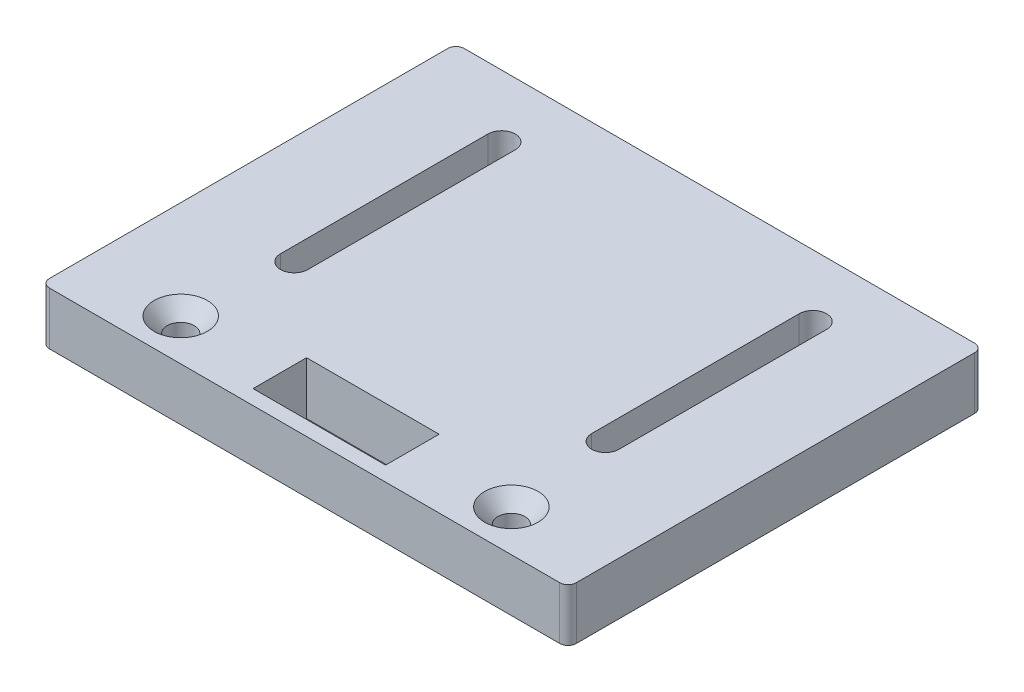
from build123d import *

# Parameters (mm, degrees)
SKETCH1_W                                        = 127
SKETCH1_H                                        = 100
BOSS_EXTRUDE1_DEPTH                              = 12.7
CUT_EXTRUDE1_DEPTH                               = 12.7
CUT_EXTRUDE2_DEPTH                               = 163.142807426
FILLET1_R                                        = 2
CSK_FOR_1_4_FLAT_HEAD_MACHINE_SCREW1_D           = 6.5278
CSK_FOR_1_4_FLAT_HEAD_MACHINE_SCREW1_CSINK_D     = 12.8778
CSK_FOR_1_4_FLAT_HEAD_MACHINE_SCREW1_CSINK_ANGLE = 82


with BuildPart() as part:
    # Sketch1 → Boss-Extrude1 (new body)
    with BuildSketch(Plane(origin=(0, 0, 0), x_dir=(1, 0, 0), z_dir=(0, 1, 0))):
        with Locations((63.5, 50)):
            Rectangle(SKETCH1_W, SKETCH1_H)
    extrude(amount=BOSS_EXTRUDE1_DEPTH)

    # Sketch2 → Cut-Extrude1 (cut)
    with BuildSketch(Plane(origin=(0, 12.7, 0), x_dir=(1, 0, 0), z_dir=(0, 1, 0))):
        Polygon((47.53, 10), (47.53, 16.45), (79.48, 16.45), (79.48, 10), (79.48, 3.55), (47.53, 3.55), align=None)
    extrude(amount=-CUT_EXTRUDE1_DEPTH, mode=Mode.SUBTRACT)

    # Sketch6 → Cut-Extrude2 (cut, through all)
    with BuildSketch(Plane(origin=(0, 12.7, 0), x_dir=(1, 0, 0), z_dir=(0, 1, 0))):
        with BuildLine():
            Line((22.690847092, 35), (22.690847092, 85))
            ThreePointArc((22.690847092, 85), (25.990847092, 88.3), (29.290847092, 85))
            Line((29.290847092, 85), (29.290847092, 35))
            ThreePointArc((29.290847092, 35), (25.990847092, 31.7), (22.690847092, 35))
        make_face()
        with BuildLine():
            Line((97.720847092, 35.000004619), (97.720847092, 84.999995381))
            ThreePointArc((97.720847092, 84.999995381), (100.881876157, 88.297072501), (104.30914268, 85.2776907))
            Line((104.30914268, 85.2776907), (104.30914268, 35.2776907))
            ThreePointArc((104.30914268, 35.2776907), (101.159813412, 31.702927304), (97.720847092, 35.000004619))
        make_face()
    extrude(amount=-CUT_EXTRUDE2_DEPTH, mode=Mode.SUBTRACT)

    # Fillet1
    fillet1_edges = [part.edges().sort_by_distance(p)[0] for p in [
        (0, 6.35, -100),
        (127, 6.35, -100),
        (127, 6.35, 0),
        (0, 6.35, 0),
    ]]
    fillet(fillet1_edges, radius=FILLET1_R)

    # CSK for 1/4 Flat Head Machine Screw1 (through all)
    with Locations(Plane(origin=(23.65, 12.7, -9.996892397), x_dir=(0, 0, 1), z_dir=(0, 1, 0))):
        with Locations((0, 0), (0, 79.7)):
            CounterSinkHole(CSK_FOR_1_4_FLAT_HEAD_MACHINE_SCREW1_D / 2, CSK_FOR_1_4_FLAT_HEAD_MACHINE_SCREW1_CSINK_D / 2, counter_sink_angle=CSK_FOR_1_4_FLAT_HEAD_MACHINE_SCREW1_CSINK_ANGLE)


solid = part.part
